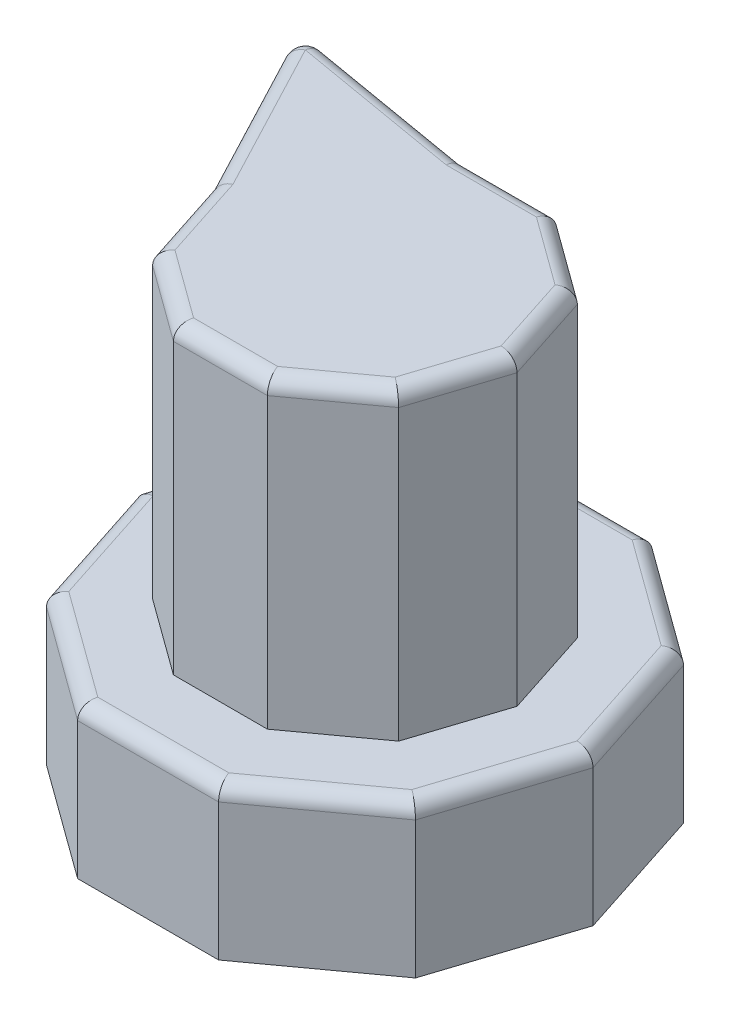
from build123d import *

# Parameters (mm, degrees)
BOSS_EXTRUDE1_DEPTH = 10
BOSS_EXTRUDE2_DEPTH = 20
BOSS_EXTRUDE3_REACH = 38.449
FILLET1_R           = 1
CUT_EXTRUDE1_DEPTH  = 7


with BuildPart() as part:
    # Sketch1 → Boss-Extrude1 (new body)
    with BuildSketch(Plane(origin=(0, 0, 0), x_dir=(1, 0, 0), z_dir=(0, 1, 0))):
        Polygon((15, 0), (12.135254916, 8.816778784), (4.635254916, 14.265847744), (-4.635254916, 14.265847744), (-12.135254916, 8.816778784), (-15, 0), (-12.135254916, -8.816778784), (-4.635254916, -14.265847744), (4.635254916, -14.265847744), (12.135254916, -8.816778784), align=None)
    extrude(amount=BOSS_EXTRUDE1_DEPTH)

    # Sketch2 → Boss-Extrude2 (add)
    with BuildSketch(Plane(origin=(0, 10, 0), x_dir=(1, 0, 0), z_dir=(0, 1, 0))):
        Polygon((10, 0), (8.090169944, 5.877852523), (3.090169944, 9.510565163), (-3.090169944, 9.510565163), (-8.090169944, 5.877852523), (-10, 0), (-8.090169944, -5.877852523), (-3.090169944, -9.510565163), (3.090169944, -9.510565163), (8.090169944, -5.877852523), align=None)
    extrude(amount=BOSS_EXTRUDE2_DEPTH)

    # Boss-Extrude3: up to this face of the body (flat: up to its plane)
    boss_extrude3_end = Plane(part.part.faces().sort_by_distance((0, 0, 0))[0])
    # Sketch3 → Boss-Extrude3 (add, up to the picked face)
    with BuildSketch(Plane(origin=(0, 30, 0), x_dir=(1, 0, 0), z_dir=(0, 1, 0)), mode=Mode.PRIVATE) as boss_extrude3_sk1:
        Polygon((-16.180339887, 11.755705046), (-10, 0), (-8.090169944, 5.877852523), align=None)
    boss_extrude3_tool1 = split(extrude(boss_extrude3_sk1.sketch, amount=-BOSS_EXTRUDE3_REACH, mode=Mode.PRIVATE), bisect_by=boss_extrude3_end, keep=Keep.BOTH, mode=Mode.PRIVATE)
    # Sketch3 → Boss-Extrude3 (add, up to the picked face)
    with BuildSketch(Plane(origin=(0, 30, 0), x_dir=(1, 0, 0), z_dir=(0, 1, 0)), mode=Mode.PRIVATE) as boss_extrude3_sk2:
        Polygon((-3.090169944, 9.510565163), (-16.180339887, 11.755705046), (-8.090169944, 5.877852523), align=None)
    boss_extrude3_tool2 = split(extrude(boss_extrude3_sk2.sketch, amount=-BOSS_EXTRUDE3_REACH, mode=Mode.PRIVATE), bisect_by=boss_extrude3_end, keep=Keep.BOTH, mode=Mode.PRIVATE)
    add(boss_extrude3_tool1.solids().sort_by(Axis((-11.423503, 30, -5.877853), (0, -1, 0)))[0])
    add(boss_extrude3_tool2.solids().sort_by(Axis((-9.120227, 30, -9.048041), (0, -1, 0)))[0])

    # Fillet1
    fillet1_edges = [part.edges().sort_by_distance(p)[0] for p in [
        (8.385254916, 10, -11.541313264),
        (0, 10, -14.265847744),
        (-7.135254916, 10, -12.449491424),
        (-13.567627458, 10, 4.408389392),
        (-8.385254916, 10, 11.541313264),
        (0, 10, 14.265847744),
        (9.045084972, 30, 2.938926261),
        (9.045084972, 30, -2.938926261),
        (5.590169944, 30, -7.694208843),
        (0, 30, -9.510565163),
        (-9.045084972, 30, 2.938926261),
        (-5.590169944, 30, 7.694208843),
        (0, 30, 9.510565163),
        (5.590169944, 30, 7.694208843),
        (8.385254916, 10, 11.541313264),
        (13.567627458, 10, 4.408389392),
        (-14.045084972, 10, -2.938926261),
        (-16.180339887, 15, -11.755705046),
        (-9.635254916, 30, -10.633135104),
        (-13.090169944, 30, -5.877852523),
        (13.567627458, 10, -4.408389392),
    ]]
    fillet(fillet1_edges, radius=FILLET1_R)

    # Sketch4 → Cut-Extrude1 (cut)
    with BuildSketch(Plane(origin=(0, 0, 0), x_dir=(-1, 0, 0), z_dir=(0, -1, 0))):
        with BuildLine():
            ThreePointArc((3.45, 0), (3.281144981, 1.066108631), (2.791108631, 2.02785912))
            Line((2.791108631, 2.02785912), (-1.253976341, -0.911067141))
            Line((-1.253976341, -0.911067141), (0.557699479, -3.404624985))
            ThreePointArc((0.557699479, -3.404624985), (2.629312001, -2.233655837), (3.45, 0))
        make_face()
        with BuildLine():
            Line((-1.253976341, -0.911067141), (2.791108631, 2.02785912))
            ThreePointArc((2.791108631, 2.02785912), (-0.261594714, 3.440068052), (-3.065652161, 1.582490703))
            Line((-3.065652161, 1.582490703), (-1.253976341, -0.911067141))
        make_face()
    extrude(amount=-CUT_EXTRUDE1_DEPTH, mode=Mode.SUBTRACT)


solid = part.part
